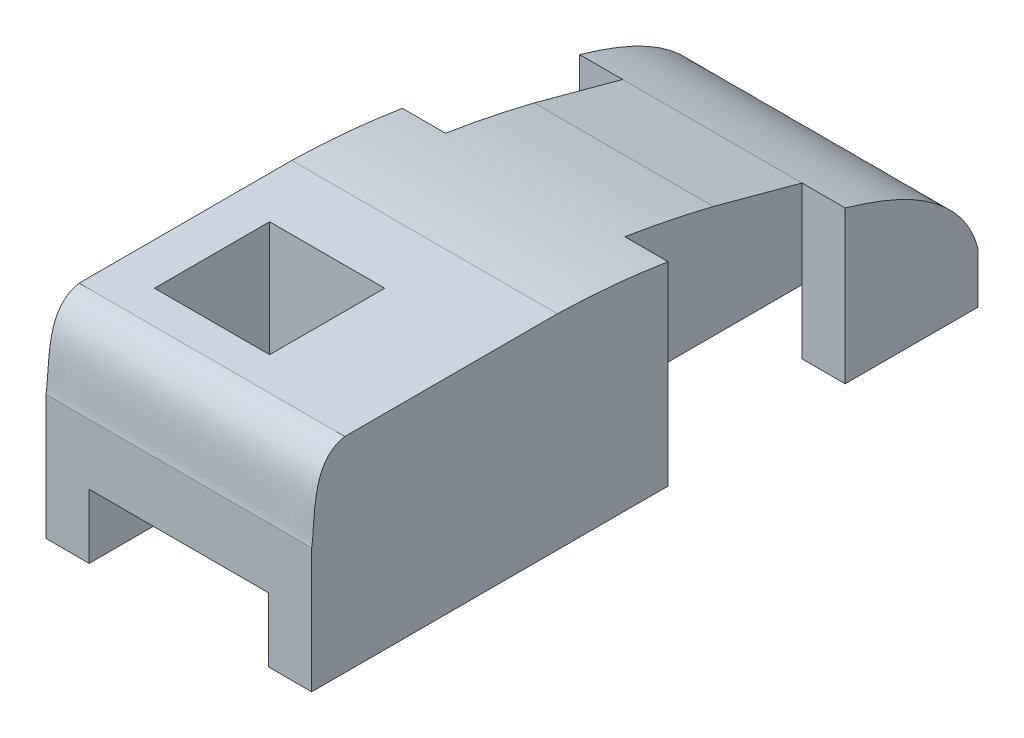
from build123d import *

# Parameters (mm, degrees)
SKETCH_1_W                = 100
SKETCH_1_H                = 185
EXTRUDE_1_DEPTH           = 100
SKETCH_2_W                = 100
SKETCH_2_H                = 3.8
CUT_EXTRUDE_1_DEPTH       = 155
CUT_EXTRUDE_2_DEPTH       = 155
SKETCH_4_W                = 25.5
SKETCH_4_H                = 25.5
CUT_EXTRUDE_3_DEPTH       = 79
SKETCH_6_W                = 89.706259743
SKETCH_6_H                = 10
SKETCH_6_W_2              = 10.293740257
CUT_EXTRUDE_4_DEPTH       = 146.107718609
CUT_EXTRUDE_5_DEPTH       = 169.985946161
CUT_EXTRUDE_5_DEPTH_BACK  = 169.985946161
SKETCH_7_W                = 20
SKETCH_7_H                = 3.8
EXTRUDE_4_DEPTH           = 160
SKETCH_10_W               = 16
SKETCH_10_H               = 1.8
CUT_EXTRUDE_6_DEPTH       = 155
SKETCH_13_W               = 20
SKETCH_13_H               = 175
CUT_EXTRUDE_7_DEPTH       = 143.515578096
SKETCH_14_W               = 175
SKETCH_14_H               = 50
CUT_EXTRUDE_8_DEPTH       = 149.849756466
SKETCH_15_W               = 60
SKETCH_15_H               = 10
CUT_EXTRUDE_9_DEPTH       = 108.660066877
SKETCH_16_W               = 60
SKETCH_16_H               = 14.5
CUT_EXTRUDE_10_DEPTH      = 108.660066877
CUT_EXTRUDE_11_DEPTH      = 111.381157812
CUT_EXTRUDE_21_DEPTH      = 162.400898529
CUT_EXTRUDE_21_DEPTH_BACK = 140.5
CUT_EXTRUDE_26_DEPTH      = 111.381157983
SKETCH_34_W               = 10
SKETCH_34_H               = 20
CUT_EXTRUDE_31_DEPTH      = 96.490523251
SKETCH_35_W               = 18.74373947
SKETCH_35_H               = 80.5
CUT_EXTRUDE_32_DEPTH      = 14
CUT_EXTRUDE_35_DEPTH      = 60
CUT_EXTRUDE_36_DEPTH      = 140.5
SKETCH_43_W               = 0.25
SKETCH_43_H               = 0.002112168
CUT_EXTRUDE_37_DEPTH      = 140.5
SKETCH_44_W               = 7.5
SKETCH_44_H               = 0.502112168
CUT_EXTRUDE_38_DEPTH      = 80.4999
SKETCH_45_W               = 9.75
SKETCH_45_H               = 20
SKETCH_45_W_2             = 9.75146362
CUT_EXTRUDE_39_DEPTH      = 96.490523251
SKETCH_46_W               = 0.24853638
SKETCH_46_H               = 20
SKETCH_46_W_2             = 0.25
EXTRUDE_5_DEPTH           = 31.697888
CUT_EXTRUDE_40_DEPTH      = 106.399537724
CUT_EXTRUDE_40_DEPTH_BACK = 106.399537724
SKETCH_54_W               = 25.5
SKETCH_54_H               = 0.5
CUT_EXTRUDE_41_DEPTH      = 29
SKETCH_55_W               = 26
SKETCH_55_H               = 26
EXTRUDE_6_DEPTH           = 29
SKETCH_56_W               = 26
SKETCH_56_H               = 26
CUT_EXTRUDE_42_DEPTH      = 29


with BuildPart() as part:
    # 草图1 → 凸台-拉伸1 (new body)
    with BuildSketch(Plane(origin=(0, 0, 0), x_dir=(1, 0, 0), z_dir=(0, 1, 0))):
        Rectangle(SKETCH_1_W, SKETCH_1_H)
    extrude(amount=EXTRUDE_1_DEPTH)

    # 草图2 → 切除-拉伸1 (cut)
    with BuildSketch(Plane.XY.offset(92.5)):
        with Locations((0, 1.9)):
            Rectangle(SKETCH_2_W, SKETCH_2_H)
    extrude(amount=-CUT_EXTRUDE_1_DEPTH, mode=Mode.SUBTRACT)

    # 草图3 → 切除-拉伸2 (cut)
    with BuildSketch(Plane.XY.offset(92.5)):
        with BuildLine():
            Line((-20, 3.8), (-3.51, 3.8))
            ThreePointArc((-3.51, 3.8), (-3.949598778, 3.901619975), (-4.3, 4.185860522))
            Line((-4.3, 4.185860522), (-9.371869735, 10.69267521))
            ThreePointArc((-9.371869735, 10.69267521), (-9.267749528, 11.143089764), (-8.9765156, 11.502112168))
            Line((-8.9765156, 11.502112168), (-4.5, 11.502112168))
            ThreePointArc((-4.5, 11.502112168), (-4.146446609, 11.648558777), (-4, 12.002112168))
            Line((-4, 12.002112168), (-4, 16.002112168))
            Line((-4, 16.002112168), (-20, 16.002112168))
            Line((-20, 16.002112168), (-20, 3.8))
        make_face()
        with BuildLine():
            ThreePointArc((4.3, 4.185860522), (3.949598778, 3.901619975), (3.51, 3.8))
            Line((3.51, 3.8), (20, 3.8))
            Line((20, 3.8), (20, 16.002112168))
            Line((20, 16.002112168), (4, 16.002112168))
            Line((4, 16.002112168), (4, 12.002112168))
            ThreePointArc((4, 12.002112168), (4.146446609, 11.648558777), (4.5, 11.502112168))
            Line((4.5, 11.502112168), (8.9765156, 11.502112168))
            ThreePointArc((8.9765156, 11.502112168), (9.426930154, 11.220838522), (9.371869735, 10.69267521))
            Line((9.371869735, 10.69267521), (4.3, 4.185860522))
        make_face()
    extrude(amount=-CUT_EXTRUDE_2_DEPTH, mode=Mode.SUBTRACT)

    # 草图4 → 切除-拉伸3 (cut)
    with BuildSketch(Plane(origin=(0, 100, 0), x_dir=(1, 0, 0), z_dir=(0, 1, 0))):
        with Locations((7.75, -50.25)):
            Rectangle(SKETCH_4_W, SKETCH_4_H)
    extrude(amount=-CUT_EXTRUDE_3_DEPTH, mode=Mode.SUBTRACT)

    # 草图6 → 切除-拉伸4 (cut, through all)
    with BuildSketch(Plane(origin=(0, 100, 0), x_dir=(1, 0, 0), z_dir=(0, 1, 0))):
        with Locations((5.146870128, 87.5)):
            Rectangle(SKETCH_6_W, SKETCH_6_H)
        with Locations((-44.853129872, 87.5)):
            Rectangle(SKETCH_6_W_2, SKETCH_6_H)
    extrude(amount=-CUT_EXTRUDE_4_DEPTH, mode=Mode.SUBTRACT)

    # 草图7 → 切除-拉伸5 (cut, two sides: drawn at the far end of the back side and taken through both)
    with BuildSketch(Plane.ZY.offset(50).offset(-CUT_EXTRUDE_5_DEPTH_BACK)):
        with Locations((-72.5, 1.9)):
            Rectangle(SKETCH_7_W, SKETCH_7_H)
    extrude(amount=CUT_EXTRUDE_5_DEPTH + CUT_EXTRUDE_5_DEPTH_BACK, mode=Mode.SUBTRACT)

    # 草图9 → 凸台-拉伸4 (add)
    with BuildSketch(Plane.XY.offset(92.5)):
        Polygon((-9.371869735, 10.69267521), (-9.371869735, 13.29267521), (-4, 13.29267521), (4, 13.29267521), (9.371869735, 13.29267521), (9.371869735, 10.69267521), align=None)
    extrude(amount=-EXTRUDE_4_DEPTH)

    # 草图10 → 切除-拉伸6 (cut)
    with BuildSketch(Plane.XY.offset(92.5)):
        with Locations((-12, 16.902112168)):
            Rectangle(SKETCH_10_W, SKETCH_10_H)
        Polygon((4, 16.002112168), (4, 17.802112168), (19.99853638, 17.802112168), (20, 16.002112168), align=None)
    extrude(amount=-CUT_EXTRUDE_6_DEPTH, mode=Mode.SUBTRACT)

    # 草图13 → 切除-拉伸7 (cut, through all)
    with BuildSketch(Plane.XZ.offset(-3.8)):
        with Locations((-40, 5)):
            Rectangle(SKETCH_13_W, SKETCH_13_H)
        with Locations((40, 5)):
            Rectangle(SKETCH_13_W, SKETCH_13_H)
    extrude(amount=-CUT_EXTRUDE_7_DEPTH, mode=Mode.SUBTRACT)

    # 草图14 → 切除-拉伸8 (cut, through all)
    with BuildSketch(Plane(origin=(30, 0, 0), x_dir=(0, 0, -1), z_dir=(1, 0, 0))):
        with Locations((-5, 75)):
            Rectangle(SKETCH_14_W, SKETCH_14_H)
    extrude(amount=-CUT_EXTRUDE_8_DEPTH, mode=Mode.SUBTRACT)

    # 草图15 → 切除-拉伸9 (cut, through all)
    with BuildSketch(Plane.XZ.offset(-3.8)):
        with Locations((0, -77.5)):
            Rectangle(SKETCH_15_W, SKETCH_15_H)
    extrude(amount=-CUT_EXTRUDE_9_DEPTH, mode=Mode.SUBTRACT)

    # 草图16 → 切除-拉伸10 (cut, through all)
    with BuildSketch(Plane(origin=(0, 50, 0), x_dir=(1, 0, 0), z_dir=(0, 1, 0))):
        with Locations((0, -85.25)):
            Rectangle(SKETCH_16_W, SKETCH_16_H)
    extrude(amount=-CUT_EXTRUDE_10_DEPTH, mode=Mode.SUBTRACT)

    # 草图17 → 切除-拉伸11 (cut, through all)
    with BuildSketch(Plane(origin=(30, 0, 0), x_dir=(0, 0, -1), z_dir=(1, 0, 0))):
        with BuildLine():
            Line((72.5, 50), (-22.5, 50))
            add(Edge.make_bspline(
                [(-22.5, 50), (-9.330669895, 49.706144403), (11.085821801, 46.827148239), (38.239751221, 39.498978447), (59.688603115, 33.272875951), (70.679662454, 22.295526596), (72.5, 15.311284203)],
                knots=[0, 0, 0, 0, 0.374533404, 0.581855131, 0.802431491, 1, 1, 1, 1], degree=3))
            Line((72.5, 15.311284203), (72.5, 50))
        make_face()
    extrude(amount=-CUT_EXTRUDE_11_DEPTH, mode=Mode.SUBTRACT)

    # 草图24 → 切除-拉伸21 (cut, two sides: drawn at the far end of the back side and taken through both)
    with BuildSketch(Plane.XY.offset(78).offset(-CUT_EXTRUDE_21_DEPTH_BACK)):
        with BuildLine():
            Line((9.371869735, 11.309008937), (9.371869735, 10.69267521))
            ThreePointArc((9.371869735, 10.69267521), (9.477785695, 11.000842073), (9.371869735, 11.309008937))
        make_face()
    extrude(amount=CUT_EXTRUDE_21_DEPTH + CUT_EXTRUDE_21_DEPTH_BACK, mode=Mode.SUBTRACT)

    # 草图28 → 切除-拉伸26 (cut, through all)
    with BuildSketch(Plane(origin=(30, 0, 0), x_dir=(0, 0, -1), z_dir=(1, 0, 0))):
        with BuildLine():
            Line((-70.5, 50), (-78, 50))
            Line((-78, 50), (-78, 31.982866201))
            add(Edge.make_bspline(
                [(-70.5, 50), (-78.410932033, 48.656434308), (-77.0737544, 36.843285786), (-78, 31.982866201)],
                knots=[0, 0, 0, 0, 1, 1, 1, 1], degree=3))
        make_face()
    extrude(amount=-CUT_EXTRUDE_26_DEPTH, mode=Mode.SUBTRACT)

    # 草图34 → 切除-拉伸31 (cut, through all)
    with BuildSketch(Plane.XZ.offset(-3.8)):
        with Locations((-25, -32.5)):
            Rectangle(SKETCH_34_W, SKETCH_34_H)
        with Locations((25, -32.5)):
            Rectangle(SKETCH_34_W, SKETCH_34_H)
    extrude(amount=-CUT_EXTRUDE_31_DEPTH, mode=Mode.SUBTRACT)

    # 草图35 → 切除-拉伸32 (cut)
    with BuildSketch(Plane.XZ.offset(-3.8)):
        with Locations((0, 37.75)):
            Rectangle(SKETCH_35_W, SKETCH_35_H)
    extrude(amount=-CUT_EXTRUDE_32_DEPTH, mode=Mode.SUBTRACT)

    # 草图40 → 切除-拉伸35 (cut)
    with BuildSketch(Plane.XY.offset(-2.5)):
        Polygon((4, 13.29267521), (4, 17.8), (3.75, 17.8), (3.75, 12.79267521), (9.371869735, 12.79267521), (9.371869735, 13.29267521), align=None)
        Polygon((-3.75, 17.8), (-4, 17.8), (-4, 13.29267521), (-9.371869735, 13.29267521), (-9.371869735, 12.79267521), (-3.75, 12.79267521), align=None)
    extrude(amount=-CUT_EXTRUDE_35_DEPTH, mode=Mode.SUBTRACT)

    # 草图41 → 切除-拉伸36 (cut)
    with BuildSketch(Plane.XY.offset(78)):
        Polygon((-3.75, 18.302112168), (-20.25, 18.302112168), (-20.25, 3.8), (-20, 3.8), (-20, 17.802112168), (-3.75, 17.802112168), align=None)
        Polygon((3.75, 18.302112168), (3.75, 17.802112168), (19.99853638, 17.802112168), (19.99853638, 3.8), (20.24853638, 3.8), (20.24853638, 18.302112168), align=None)
    extrude(amount=-CUT_EXTRUDE_36_DEPTH, mode=Mode.SUBTRACT)

    # 草图43 → 切除-拉伸37 (cut)
    with BuildSketch(Plane.XY.offset(78)):
        with Locations((-3.875, 17.801056084)):
            Rectangle(SKETCH_43_W, SKETCH_43_H)
        with Locations((3.875, 17.801056084)):
            Rectangle(SKETCH_43_W, SKETCH_43_H)
    extrude(amount=-CUT_EXTRUDE_37_DEPTH, mode=Mode.SUBTRACT)

    # 草图44 → 切除-拉伸38 (cut)
    with BuildSketch(Plane.XY.offset(78)):
        with Locations((0, 18.051056084)):
            Rectangle(SKETCH_44_W, SKETCH_44_H)
    extrude(amount=-CUT_EXTRUDE_38_DEPTH, mode=Mode.SUBTRACT)

    # 草图45 → 切除-拉伸39 (cut, through all)
    with BuildSketch(Plane.XZ.offset(-3.8)):
        with Locations((-25.125, -12.5)):
            Rectangle(SKETCH_45_W, SKETCH_45_H)
        with Locations((25.12426819, -12.5)):
            Rectangle(SKETCH_45_W_2, SKETCH_45_H)
    extrude(amount=-CUT_EXTRUDE_39_DEPTH, mode=Mode.SUBTRACT)

    # 草图46 → 凸台-拉伸5 (add, through all)
    with BuildSketch(Plane.XZ.offset(-18.302112168)):
        with Locations((20.12426819, -32.5)):
            Rectangle(SKETCH_46_W, SKETCH_46_H)
        with Locations((-20.125, -32.5)):
            Rectangle(SKETCH_46_W_2, SKETCH_46_H)
    extrude(amount=-EXTRUDE_5_DEPTH)

    # 草图47 → 切除-拉伸40 (cut, two sides: drawn at the far end of the back side and taken through both)
    with BuildSketch(Plane.ZY.offset(20.25).offset(-CUT_EXTRUDE_40_DEPTH_BACK)):
        Polygon((-42.5, 38.203961841), (-22.5, 43.618048783), (-22.5, 50), (-42.5, 50), align=None)
    extrude(amount=CUT_EXTRUDE_40_DEPTH + CUT_EXTRUDE_40_DEPTH_BACK, mode=Mode.SUBTRACT)

    # 草图54 → 切除-拉伸41 (cut)
    with BuildSketch(Plane(origin=(0, 50, 0), x_dir=(1, 0, 0), z_dir=(0, 1, 0))):
        with Locations((7.75, -37.25)):
            Rectangle(SKETCH_54_W, SKETCH_54_H)
        Polygon((-5, -63), (-5, -37.5), (-5, -37), (-5.5, -37), (-5.5, -63), align=None)
    extrude(amount=-CUT_EXTRUDE_41_DEPTH, mode=Mode.SUBTRACT)

    # 草图55 → 凸台-拉伸6 (add)
    with BuildSketch(Plane(origin=(0, 50, 0), x_dir=(1, 0, 0), z_dir=(0, 1, 0))):
        with Locations((7.5, -50)):
            Rectangle(SKETCH_55_W, SKETCH_55_H)
    extrude(amount=-EXTRUDE_6_DEPTH)

    # 草图56 → 切除-拉伸42 (cut)
    with BuildSketch(Plane(origin=(0, 50, 0), x_dir=(1, 0, 0), z_dir=(0, 1, 0))):
        with Locations((-7.5, -50)):
            Rectangle(SKETCH_56_W, SKETCH_56_H)
    extrude(amount=-CUT_EXTRUDE_42_DEPTH, mode=Mode.SUBTRACT)


solid = part.part
